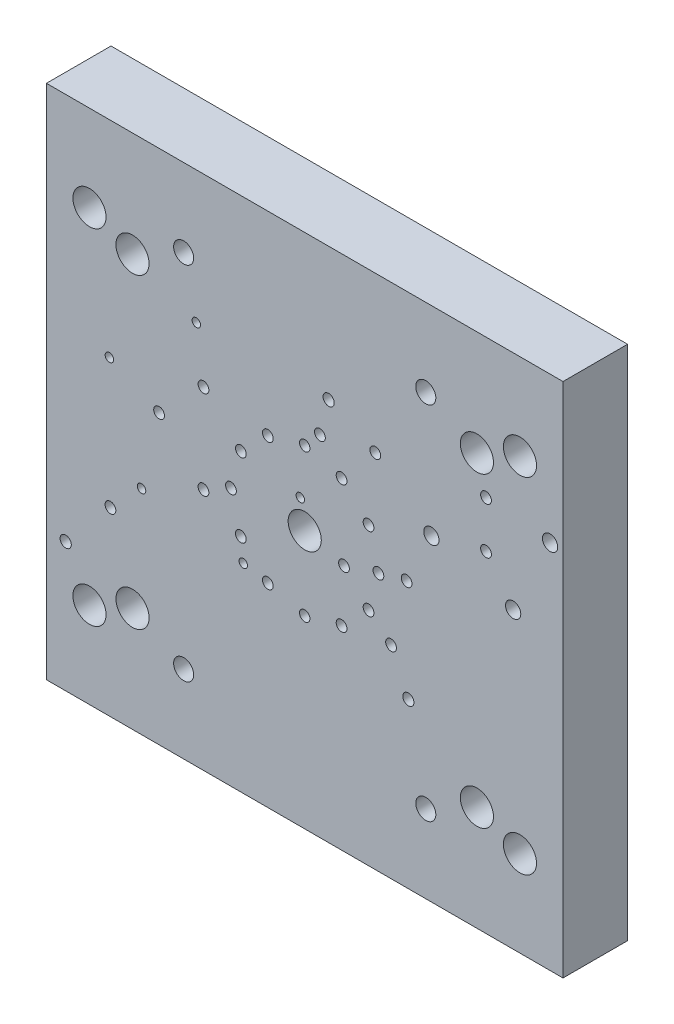
from build123d import *

# Parameters (mm, degrees)
SKETCH1_W                               = 304.8
SKETCH1_H                               = 304.8
BOSS_EXTRUDE1_DEPTH                     = 38.1
SKETCH2_R                               = 6.5151
HAAS_T_SLOT_HOLES_DEPTH                 = 219.867836833
SKETCH3_R                               = 9.779
HAAS_COUNTER_BORES_DEPTH                = 22.225
SKETCH4_R                               = 6.5151
TORMACH_T_SLOT_HOLES_DEPTH              = 219.867836833
SKETCH5_R                               = 9.779
TORMACH_COUNTER_BORES_DEPTH             = 22.225
SKETCH6_R                               = 3.0734
SPROCKET_LOCATING_HOLES_DEPTH           = 6.35
SKETCH7_R                               = 3.175
SPROCKET_MOUNTING_CLEARANCE_HOLES_DEPTH = 9.525
SKETCH8_R                               = 5.9182
F_1_2_13_TAPPED_HOLES_DEPTH             = 19.05
SKETCH9_R                               = 3.175
SKETCH9_R_2                             = 3.3
SKETCH9_R_3                             = 2.5
SKETCH9_R_4                             = 4.5
CUT_EXTRUDE1_DEPTH                      = 19.05


with BuildPart() as part:
    # Sketch1 → Boss-Extrude1 (new body)
    with BuildSketch(Plane.XY):
        Rectangle(SKETCH1_W, SKETCH1_H)
    extrude(amount=BOSS_EXTRUDE1_DEPTH)

    # Sketch2 → HAAS T-Slot Holes (cut, through all)
    with BuildSketch(Plane.XY.offset(38.1)):
        with Locations((-127, 101.6)):
            Circle(SKETCH2_R)
        with Locations((127, 101.6)):
            Circle(SKETCH2_R)
        with Locations((127, -101.6)):
            Circle(SKETCH2_R)
        with Locations((-127, -101.6)):
            Circle(SKETCH2_R)
        Circle(SKETCH2_R)
    extrude(amount=-HAAS_T_SLOT_HOLES_DEPTH, mode=Mode.SUBTRACT)

    # Sketch3 → HAAS Counter Bores (cut)
    with BuildSketch(Plane.XY.offset(38.1)):
        with Locations((-127, 101.6)):
            Circle(SKETCH3_R)
        with Locations((127, 101.6)):
            Circle(SKETCH3_R)
        Circle(SKETCH3_R)
        with Locations((127, -101.6)):
            Circle(SKETCH3_R)
        with Locations((-127, -101.6)):
            Circle(SKETCH3_R)
    extrude(amount=-HAAS_COUNTER_BORES_DEPTH, mode=Mode.SUBTRACT)

    # Sketch4 → Tormach T-Slot Holes (cut, through all)
    with BuildSketch(Plane.XY.offset(38.1)):
        with Locations((-101.6, 90.4875)):
            Circle(SKETCH4_R)
        with Locations((101.6, 90.4875)):
            Circle(SKETCH4_R)
        with Locations((-101.6, -90.4875)):
            Circle(SKETCH4_R)
        with Locations((101.6, -90.4875)):
            Circle(SKETCH4_R)
    extrude(amount=-TORMACH_T_SLOT_HOLES_DEPTH, mode=Mode.SUBTRACT)

    # Sketch5 → Tormach Counter bores (cut)
    with BuildSketch(Plane.XY.offset(38.1)):
        with Locations((-101.6, 90.4875)):
            Circle(SKETCH5_R)
        with Locations((101.6, 90.4875)):
            Circle(SKETCH5_R)
        with Locations((101.6, -90.4875)):
            Circle(SKETCH5_R)
        with Locations((-101.6, -90.4875)):
            Circle(SKETCH5_R)
    extrude(amount=-TORMACH_COUNTER_BORES_DEPTH, mode=Mode.SUBTRACT)

    # Sketch6 → Sprocket Locating Holes (cut)
    with BuildSketch(Plane.XY.offset(38.1)):
        with Locations((0, 43.50004)):
            Circle(SKETCH6_R)
        with Locations((0, -43.50004)):
            Circle(SKETCH6_R)
    extrude(amount=-SPROCKET_LOCATING_HOLES_DEPTH, mode=Mode.SUBTRACT)

    # Sketch7 → Sprocket Mounting clearance holes (cut)
    with BuildSketch(Plane.XY.offset(38.1)):
        with Locations((43.50004, 0)):
            Circle(SKETCH7_R)
        with Locations((37.672139706, -21.75002)):
            Circle(SKETCH7_R)
        with Locations((21.75002, -37.672139706)):
            Circle(SKETCH7_R)
        with Locations((-21.75002, -37.672139706)):
            Circle(SKETCH7_R)
        with Locations((-37.672139706, -21.75002)):
            Circle(SKETCH7_R)
        with Locations((-43.50004, 0)):
            Circle(SKETCH7_R)
        with Locations((-37.672139706, 21.75002)):
            Circle(SKETCH7_R)
        with Locations((-21.75002, 37.672139706)):
            Circle(SKETCH7_R)
        with Locations((21.75002, 37.672139706)):
            Circle(SKETCH7_R)
        with Locations((37.672139706, 21.75002)):
            Circle(SKETCH7_R)
    extrude(amount=-SPROCKET_MOUNTING_CLEARANCE_HOLES_DEPTH, mode=Mode.SUBTRACT)

    # Sketch8 → 1/2-13 Tapped Holes (cut)
    with BuildSketch(Plane.XY.offset(38.1)):
        with Locations((-71.4375, 106.4641)):
            Circle(SKETCH8_R)
        with Locations((71.4375, 106.4641)):
            Circle(SKETCH8_R)
        with Locations((71.4375, -106.4641)):
            Circle(SKETCH8_R)
        with Locations((-71.4375, -106.4641)):
            Circle(SKETCH8_R)
    extrude(amount=-F_1_2_13_TAPPED_HOLES_DEPTH, mode=Mode.SUBTRACT)

    # Sketch9 → Cut-Extrude1 (cut)
    with BuildSketch(Plane.XY.offset(38.1)):
        with Locations((106.975954286, 70.395873002)):
            Circle(SKETCH9_R)
        with Locations((106.975954286, 42.900373002)):
            Circle(SKETCH9_R)
        with Locations((8.985545702, 53.468225166)):
            Circle(SKETCH9_R)
        with Locations((41.65587457, 60.657920909)):
            Circle(SKETCH9_R)
        with Locations((-59.73361009, 43.51546635)):
            Circle(SKETCH9_R)
        with Locations((-85.92736009, 17.32171635)):
            Circle(SKETCH9_R)
        with Locations((-59.73361009, -8.87203365)):
            Circle(SKETCH9_R)
        with Locations((-114.633914907, -45.510351778)):
            Circle(SKETCH9_R)
        with Locations((-141.027605333, -76.084724647)):
            Circle(SKETCH9_R_2)
        with Locations((61.148073745, -55.642324401)):
            Circle(SKETCH9_R_2)
        with Locations((23.174346831, -6.319418914)):
            Circle(SKETCH9_R)
        with Locations((60.142975062, 4.412421641)):
            Circle(SKETCH9_R)
        with Locations((50.952707496, -32.969269828)):
            Circle(SKETCH9_R)
        with Locations((-36.264061896, -34.786851156)):
            Circle(SKETCH9_R_3)
        with Locations((-96.280107569, -26.615466331)):
            Circle(SKETCH9_R_3)
        with Locations((-115.245018307, 30.908697539)):
            Circle(SKETCH9_R_3)
        with Locations((-63.965591615, 74.314810953)):
            Circle(SKETCH9_R_3)
        with Locations((-2.610367098, 15.573114042)):
            Circle(SKETCH9_R_3)
        with Locations((14.128233333, 73.914299226)):
            Circle(SKETCH9_R_2)
        with Locations((74.737676016, 34.700608013)):
            Circle(SKETCH9_R_4)
        with Locations((144.776518705, 66.245900326)):
            Circle(SKETCH9_R_4)
        with Locations((122.991918933, 21.088470635)):
            Circle(SKETCH9_R_4)
    extrude(amount=-CUT_EXTRUDE1_DEPTH, mode=Mode.SUBTRACT)


solid = part.part
